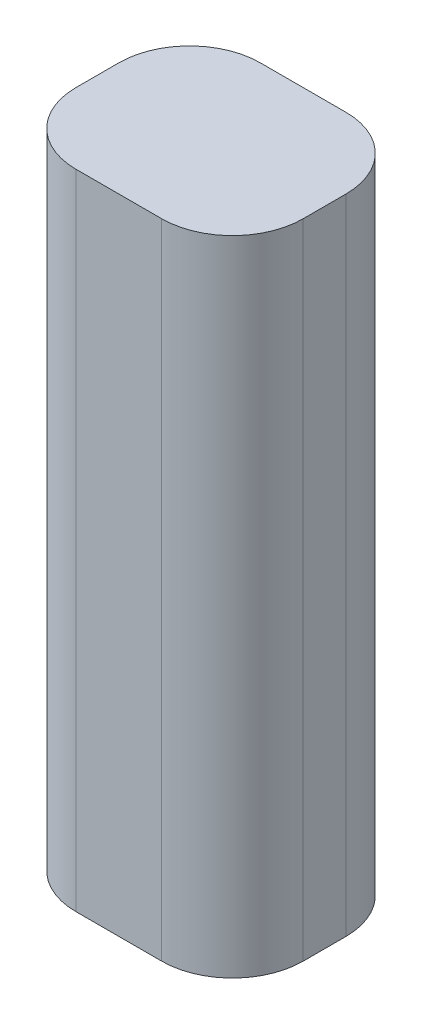
from build123d import *

# Parameters (mm, degrees)
BOSS_EXTRUDE3_DEPTH = 15


with BuildPart() as part:
    # Sketch1 → Boss-Extrude3 (new body)
    with BuildSketch(Plane(origin=(0, 0, 0), x_dir=(1, 0, 0), z_dir=(0, 1, 0))):
        with BuildLine():
            Line((2.65, -0.5), (2.65, 0.5))
            ThreePointArc((2.65, 0.5), (2.166726189, 1.666726189), (1, 2.15))
            Line((1, 2.15), (-1, 2.15))
            ThreePointArc((-1, 2.15), (-2.166726189, 1.666726189), (-2.65, 0.5))
            Line((-2.65, 0.5), (-2.65, -0.5))
            ThreePointArc((-2.65, -0.5), (-2.166726173, -1.666726205), (-0.999999956, -2.15))
            Line((-0.999999956, -2.15), (1, -2.15))
            ThreePointArc((1, -2.15), (2.166726189, -1.666726189), (2.65, -0.5))
        make_face()
    extrude(amount=BOSS_EXTRUDE3_DEPTH)


solid = part.part
